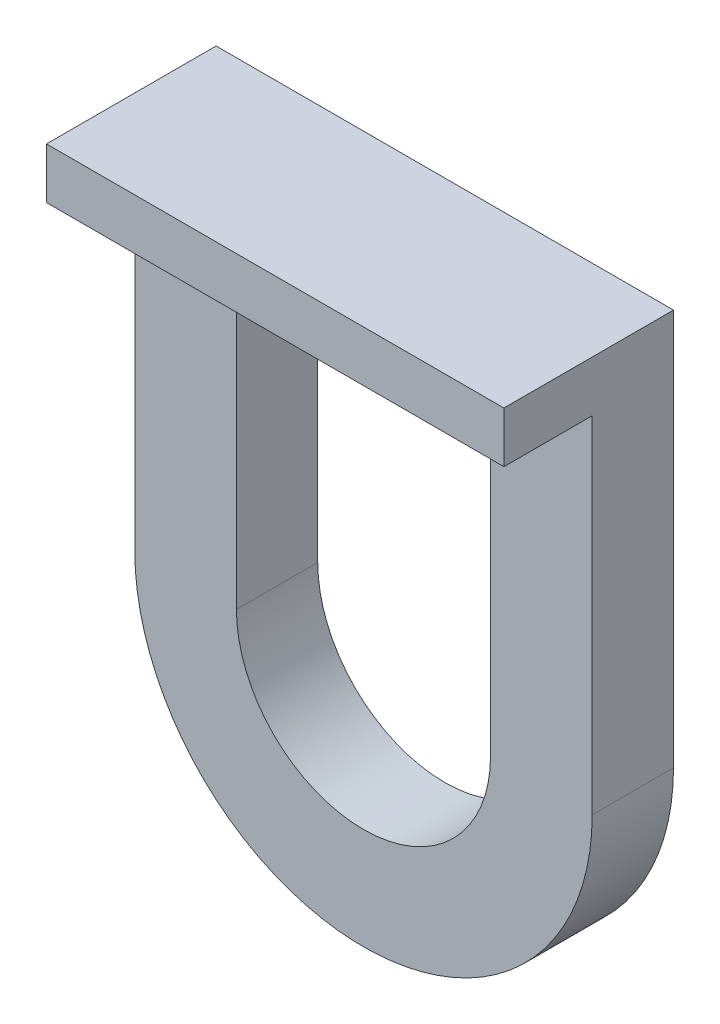
from build123d import *

# Parameters (mm, degrees)
BOSS_EXTRUDE1_DEPTH = 8
BOSS_EXTRUDE2_DEPTH = 5
SKETCH3_W           = 25
SKETCH3_H           = 5
BOSS_EXTRUDE3_DEPTH = 8


with BuildPart() as part:
    # Sketch1 → Boss-Extrude1 (new body)
    with BuildSketch(Plane.XY):
        with BuildLine():
            Line((-12.5, 0), (-12.5, 34))
            Line((-12.5, 34), (-22.5, 34))
            Line((-22.5, 34), (-22.5, 0))
            ThreePointArc((-22.5, 0), (0, -22.5), (22.5, 0))
            Line((22.5, 0), (22.5, 34))
            Line((22.5, 34), (12.5, 34))
            Line((12.5, 34), (12.5, 0))
            ThreePointArc((12.5, 0), (0, -12.5), (-12.5, 0))
        make_face()
    extrude(amount=BOSS_EXTRUDE1_DEPTH)

    # Sketch2 → Boss-Extrude2 (add)
    with BuildSketch(Plane(origin=(0, 34, 0), x_dir=(1, 0, 0), z_dir=(0, 1, 0))):
        Polygon((-22.5, 0), (-22.5, -8.684042384), (-22.5, -16.684042384), (22.5, -16.684042384), (22.5, 0), (12.5, 0), (12.5, -8), (-12.5, -8), (-12.5, 0), align=None)
    extrude(amount=BOSS_EXTRUDE2_DEPTH)

    # Sketch3 → Boss-Extrude3 (add)
    with BuildSketch(Plane(origin=(0, 0, 8), x_dir=(-1, 0, 0), z_dir=(0, 0, -1))):
        with Locations((0, 36.5)):
            Rectangle(SKETCH3_W, SKETCH3_H)
    extrude(amount=BOSS_EXTRUDE3_DEPTH)


solid = part.part
